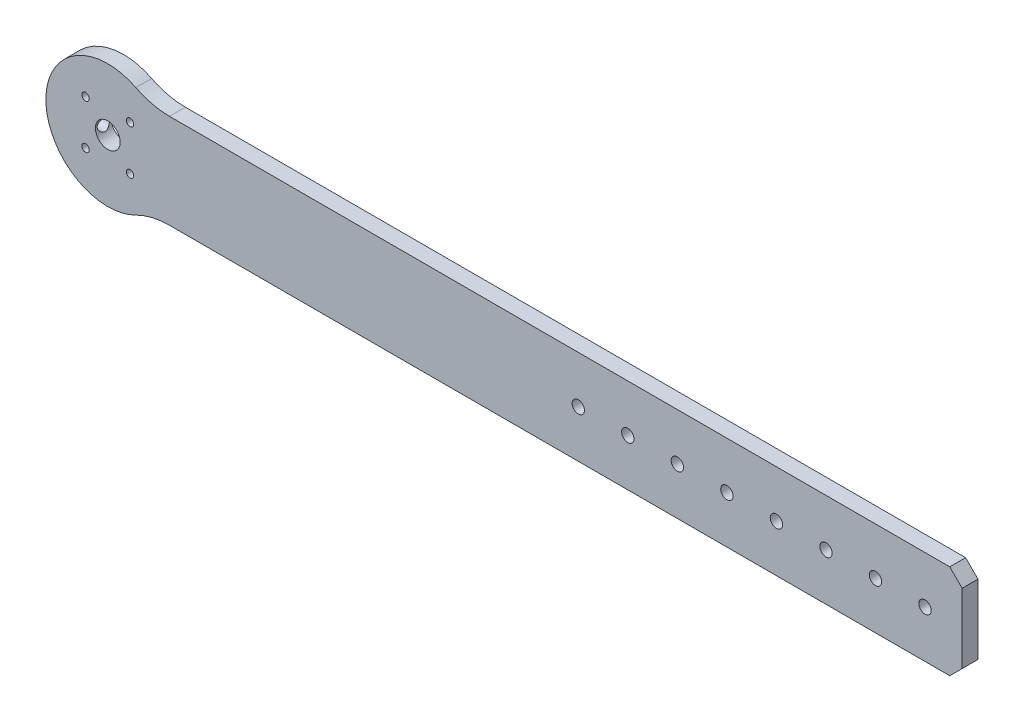
from build123d import *

# Parameters (mm, degrees)
SKETCH1_R               = 1.5
SKETCH1_R_2             = 5
SKETCH1_R_3             = 2.5
BOSS_EXTRUDE1_DEPTH     = 3.2
FILLET1_R               = 30
CHAMFER1_SIZE           = 5
CUT_EXTRUDE1_REACH      = 347.919
CUT_EXTRUDE1_END_RADIUS = 25
SKETCH3_R               = 2.5


with BuildPart() as part:
    # Sketch1 → Boss-Extrude1 (new, symmetric)
    with BuildSketch(Plane.XY):
        with BuildLine():
            Line((345, 19.05), (16.189425561, 19.05))
            ThreePointArc((16.189425561, 19.05), (-25, 0), (16.189425561, -19.05))
            Line((16.189425561, -19.05), (345, -19.05))
            Line((345, -19.05), (345, 19.05))
        make_face()
        with Locations((8.980256121, 8.980256121)):
            Circle(SKETCH1_R, mode=Mode.SUBTRACT)
        Circle(SKETCH1_R_2, mode=Mode.SUBTRACT)
        with Locations((330, 0)):
            Circle(SKETCH1_R_3, mode=Mode.SUBTRACT)
        with Locations((310, 0)):
            Circle(SKETCH1_R_3, mode=Mode.SUBTRACT)
        with Locations((290, 0)):
            Circle(SKETCH1_R_3, mode=Mode.SUBTRACT)
        with Locations((270, 0)):
            Circle(SKETCH1_R_3, mode=Mode.SUBTRACT)
        with Locations((250, 0)):
            Circle(SKETCH1_R_3, mode=Mode.SUBTRACT)
        with Locations((230, 0)):
            Circle(SKETCH1_R_3, mode=Mode.SUBTRACT)
        with Locations((210, 0)):
            Circle(SKETCH1_R_3, mode=Mode.SUBTRACT)
        with Locations((190, 0)):
            Circle(SKETCH1_R_3, mode=Mode.SUBTRACT)
        with Locations((8.980256121, -8.980256121)):
            Circle(SKETCH1_R, mode=Mode.SUBTRACT)
        with Locations((-8.980256121, -8.980256121)):
            Circle(SKETCH1_R, mode=Mode.SUBTRACT)
        with Locations((-8.980256121, 8.980256121)):
            Circle(SKETCH1_R, mode=Mode.SUBTRACT)
    extrude(amount=BOSS_EXTRUDE1_DEPTH, both=True)

    # Fillet1
    fillet1_edges = [part.edges().sort_by_distance(p)[0] for p in [
        (16.189425561, -19.05, 0),
        (16.189425561, 19.05, 0),
    ]]
    fillet(fillet1_edges, radius=FILLET1_R)

    # Chamfer1
    chamfer1_edges = [part.edges().sort_by_distance(p)[0] for p in [
        (345, -19.05, 0),
        (345, 19.05, 0),
    ]]
    chamfer(chamfer1_edges, length=CHAMFER1_SIZE)

    # Cut-Extrude1: up to this cylinder (the profile starts inside it)
    cut_extrude1_end = Plane(origin=(0, 0, 0), z_dir=(0, 0, -1)) * Cylinder(CUT_EXTRUDE1_END_RADIUS, 746.838, mode=Mode.PRIVATE)
    # Sketch3 → Cut-Extrude1 (cut, up to the surface)
    with BuildSketch(Plane(origin=(0, 0, 0), x_dir=(0, 0, -1), z_dir=(1, 0, 0)), mode=Mode.PRIVATE) as cut_extrude1_sk1:
        Circle(SKETCH3_R)
    cut_extrude1_tool1 = extrude(cut_extrude1_sk1.sketch, amount=-CUT_EXTRUDE1_REACH, mode=Mode.PRIVATE) & cut_extrude1_end
    add(cut_extrude1_tool1.solids().sort_by_distance((0, 0, 0))[0], mode=Mode.SUBTRACT)


solid = part.part
